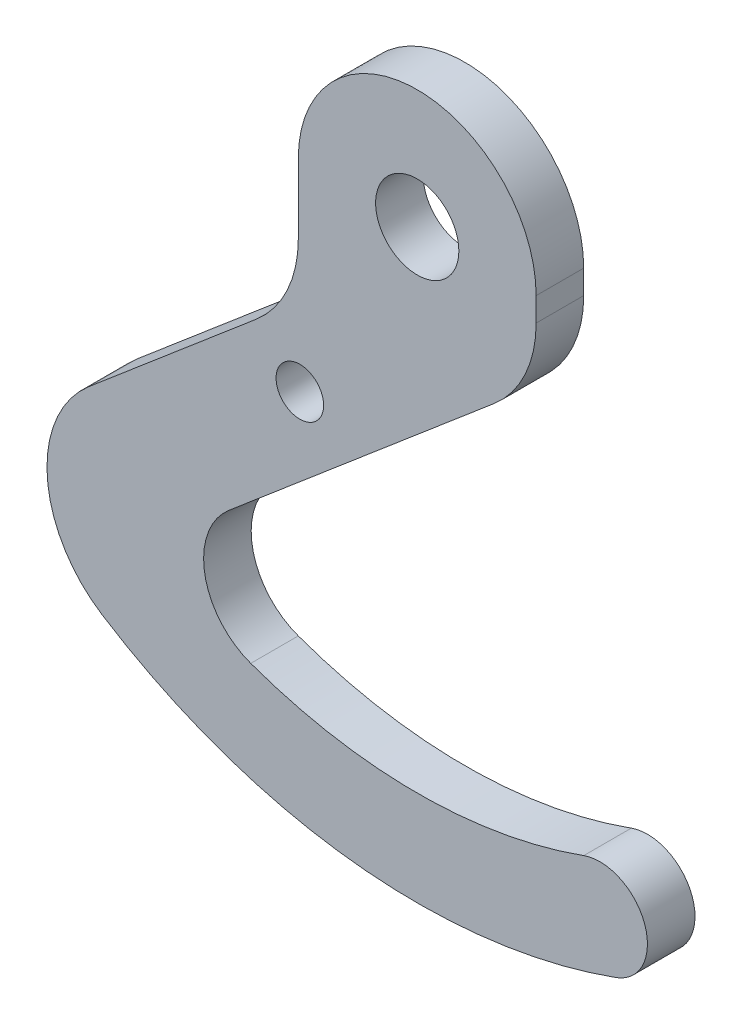
from build123d import *

# Parameters (mm, degrees)
SKETCH1_R           = 1.75
SKETCH1_R_2         = 1
BOSS_EXTRUDE1_DEPTH = 1


with BuildPart() as part:
    # Sketch1 → Boss-Extrude1 (new, symmetric)
    with BuildSketch(Plane.XY):
        with BuildLine():
            Line((-5, 0), (-5, -2.928879346))
            ThreePointArc((-5, -2.928879346), (-5.462566041, -5.029282419), (-6.764677227, -6.741055438))
            Line((-6.764677227, -6.741055438), (-13.802331482, -12.713781389))
            ThreePointArc((-13.802331482, -12.713781389), (-15.555651524, -16.862770292), (-13.260540242, -20.738425628))
            ThreePointArc((-13.260540242, -20.738425628), (-2.732373515, -24.463408593), (8.3581995, -23.153071635))
            ThreePointArc((8.3581995, -23.153071635), (9.560275853, -20.592795782), (7, -19.39071943))
            ThreePointArc((7, -19.39071943), (0, -20.615528128), (-7, -19.39071943))
            ThreePointArc((-7, -19.39071943), (-8.933606572, -17.102043774), (-7.922544038, -14.28164962))
            Line((-7.922544038, -14.28164962), (3.235322773, -4.812176092))
            ThreePointArc((3.235322773, -4.812176092), (4.537433959, -3.100403073), (5, -1))
            Line((5, -1), (5, 0))
            ThreePointArc((5, 0), (0, 5), (-5, 0))
        make_face()
        Circle(SKETCH1_R, mode=Mode.SUBTRACT)
        with Locations((-4.935698975, -8.467802799)):
            Circle(SKETCH1_R_2, mode=Mode.SUBTRACT)
    extrude(amount=BOSS_EXTRUDE1_DEPTH, both=True)


solid = part.part
